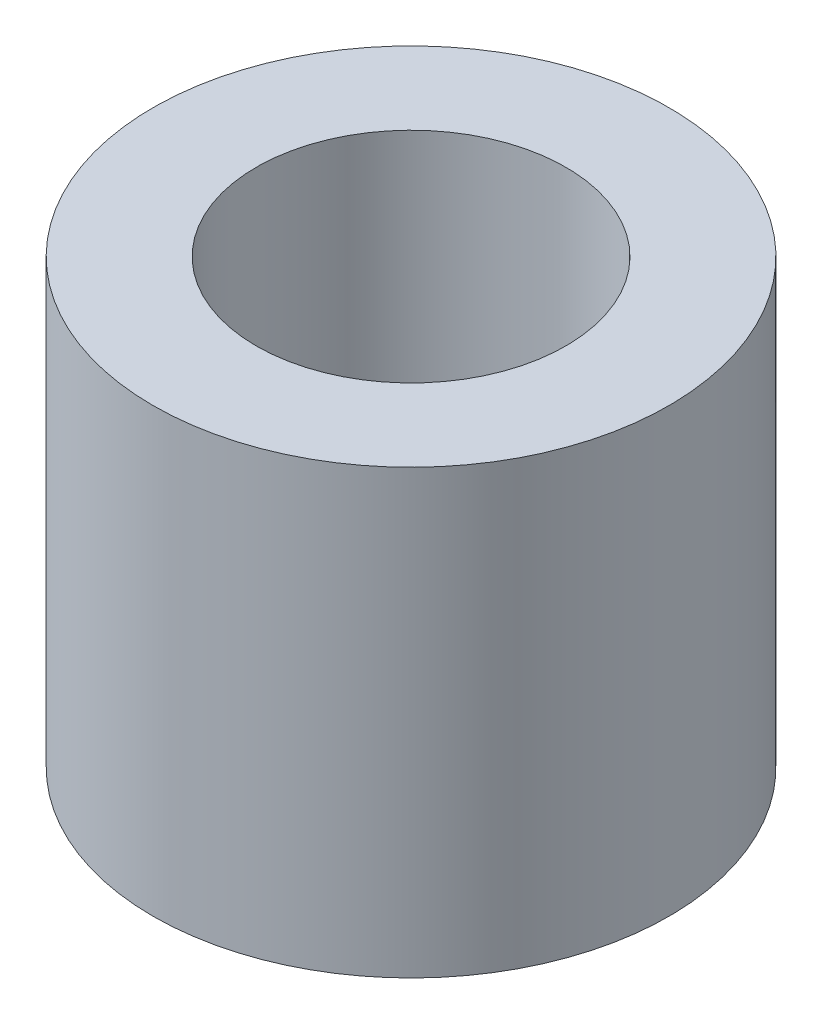
from build123d import *

# Parameters (mm, degrees)
SKETCH_1_R      = 3.5
SKETCH_1_R_2    = 2.1
EXTRUDE_1_DEPTH = 6


with BuildPart() as part:
    # 草图1 → 凸台-拉伸1 (new body)
    with BuildSketch(Plane(origin=(0, 0, 0), x_dir=(1, 0, 0), z_dir=(0, 1, 0))):
        with Locations(Location((0, 0, 0), (0, 0, 270))):
            Circle(SKETCH_1_R)
        with Locations(Location((0, 0, 0), (0, 0, 270))):
            Circle(SKETCH_1_R_2, mode=Mode.SUBTRACT)
    extrude(amount=EXTRUDE_1_DEPTH)


solid = part.part
